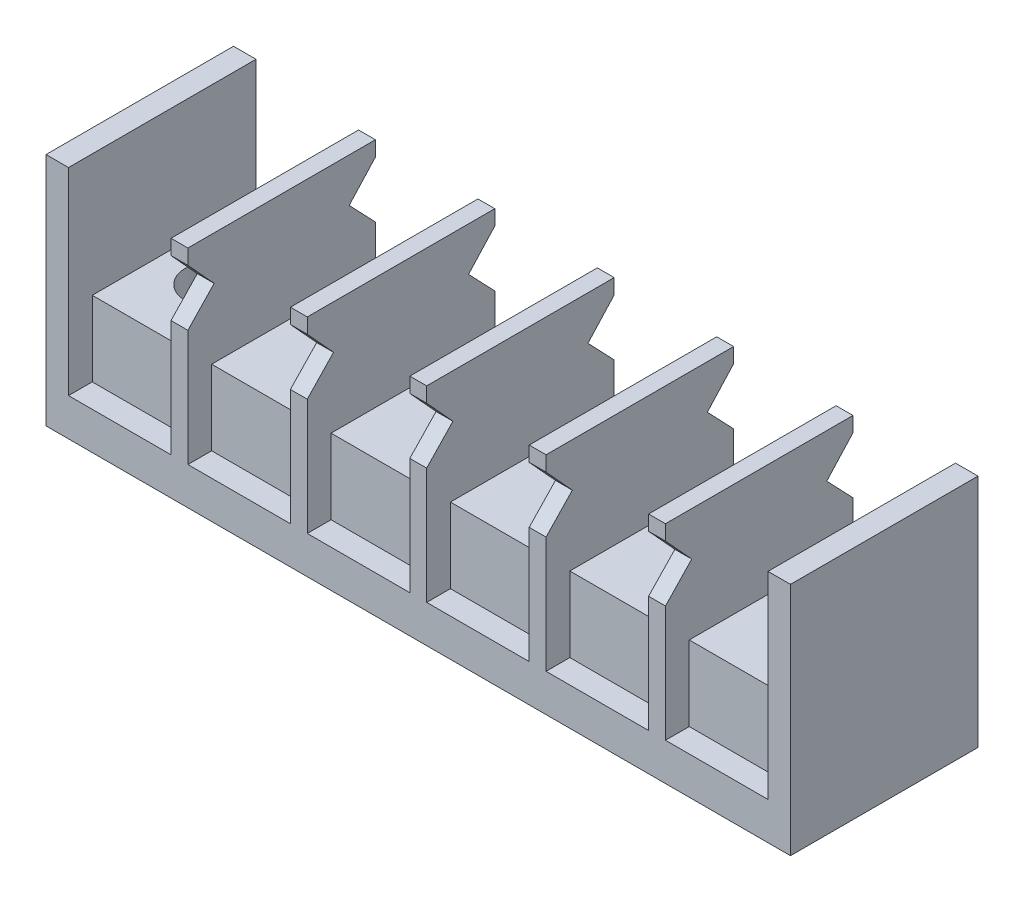
from build123d import *

# Parameters (mm, degrees)
SKETCH_1_W          = 59.55
SKETCH_1_H          = 15
EXTRUDE_1_DEPTH     = 18.8
SKETCH_2_W          = 55.95
SKETCH_2_H          = 15
CUT_EXTRUDE_1_DEPTH = 0.8
SKETCH_4_W          = 8.2
SKETCH_4_H          = 15
CUT_EXTRUDE_2_DEPTH = 9
SKETCH_5_W          = 8.2
SKETCH_5_H          = 1.9
CUT_EXTRUDE_3_DEPTH = 15
SKETCH_6_W          = 1.5
SKETCH_6_H          = 0.75
EXTRUDE_2_DEPTH     = 5.8
SKETCH_7_R          = 2.25
CUT_EXTRUDE_4_DEPTH = 35.085783327
CUT_EXTRUDE_START   = -39.55
CUT_EXTRUDE_5_DEPTH = 39.55


with BuildPart() as part:
    # 草图1 → 拉伸1 (new body)
    with BuildSketch(Plane(origin=(0, 0, 0), x_dir=(1, 0, 0), z_dir=(0, 1, 0))):
        Rectangle(SKETCH_1_W, SKETCH_1_H)
    extrude(amount=EXTRUDE_1_DEPTH)

    # 草图2 → 切除-拉伸1 (cut)
    with BuildSketch(Plane(origin=(0, 18.8, 0), x_dir=(-1, 0, 0), z_dir=(0, 1, 0))):
        Rectangle(SKETCH_2_W, SKETCH_2_H)
    extrude(amount=-CUT_EXTRUDE_1_DEPTH, mode=Mode.SUBTRACT)

    # 草图4 → 切除-拉伸2 (cut)
    with BuildSketch(Plane(origin=(0, 18, 0), x_dir=(-1, 0, 0), z_dir=(0, 1, 0))):
        with Locations((-23.875, 0)):
            Rectangle(SKETCH_4_W, SKETCH_4_H)
        with Locations((-14.325, 0)):
            Rectangle(SKETCH_4_W, SKETCH_4_H)
        with Locations((-4.775, 0)):
            Rectangle(SKETCH_4_W, SKETCH_4_H)
        with Locations((4.775, 0)):
            Rectangle(SKETCH_4_W, SKETCH_4_H)
        with Locations((14.325, 0)):
            Rectangle(SKETCH_4_W, SKETCH_4_H)
        with Locations((23.875, 0)):
            Rectangle(SKETCH_4_W, SKETCH_4_H)
    extrude(amount=-CUT_EXTRUDE_2_DEPTH, mode=Mode.SUBTRACT)

    # 草图5 → 切除-拉伸3 (cut)
    with BuildSketch(Plane(origin=(0, 18, 0), x_dir=(-1, 0, 0), z_dir=(0, 1, 0))):
        with Locations((23.875, -6.55)):
            Rectangle(SKETCH_5_W, SKETCH_5_H)
        with Locations((23.875, 6.55)):
            Rectangle(SKETCH_5_W, SKETCH_5_H)
        with Locations((14.325, -6.55)):
            Rectangle(SKETCH_5_W, SKETCH_5_H)
        with Locations((14.325, 6.55)):
            Rectangle(SKETCH_5_W, SKETCH_5_H)
        with Locations((4.775, -6.55)):
            Rectangle(SKETCH_5_W, SKETCH_5_H)
        with Locations((4.775, 6.55)):
            Rectangle(SKETCH_5_W, SKETCH_5_H)
        with Locations((-4.775, -6.55)):
            Rectangle(SKETCH_5_W, SKETCH_5_H)
        with Locations((-4.775, 6.55)):
            Rectangle(SKETCH_5_W, SKETCH_5_H)
        with Locations((-14.325, -6.55)):
            Rectangle(SKETCH_5_W, SKETCH_5_H)
        with Locations((-14.325, 6.55)):
            Rectangle(SKETCH_5_W, SKETCH_5_H)
        with Locations((-23.875, -6.55)):
            Rectangle(SKETCH_5_W, SKETCH_5_H)
        with Locations((-23.875, 6.55)):
            Rectangle(SKETCH_5_W, SKETCH_5_H)
    extrude(amount=-CUT_EXTRUDE_3_DEPTH, mode=Mode.SUBTRACT)

    # 草图6 → 拉伸2 (add)
    with BuildSketch(Plane.XZ):
        with Locations((-4.775, 0)):
            Rectangle(SKETCH_6_W, SKETCH_6_H)
        with Locations((4.775, 0)):
            Rectangle(SKETCH_6_W, SKETCH_6_H)
        with Locations((14.325, 0)):
            Rectangle(SKETCH_6_W, SKETCH_6_H)
        with Locations((-14.325, 0)):
            Rectangle(SKETCH_6_W, SKETCH_6_H)
    extrude(amount=EXTRUDE_2_DEPTH)

    # 草图7 → 切除-拉伸4 (cut, through all)
    with BuildSketch(Plane(origin=(0, 9, 0), x_dir=(-1, 0, 0), z_dir=(0, 1, 0))):
        with Locations(Location((-23.875, 0, 0), (0, 0, 90))):
            Circle(SKETCH_7_R)
        with Locations(Location((23.875, 0, 0), (0, 0, 270))):
            Circle(SKETCH_7_R)
    extrude(amount=-CUT_EXTRUDE_4_DEPTH, mode=Mode.SUBTRACT)

    # 草图8 → 切除-拉伸5 (cut)
    with BuildSketch(Plane(origin=(19.775, 0, 0), x_dir=(0, 0, -1), z_dir=(1, 0, 0)).offset(CUT_EXTRUDE_START)):
        Polygon((7.5, 16.8), (5.4, 14.5), (7.5, 12.3), align=None)
        Polygon((-7.5, 16.8), (-7.5, 12.3), (-5.4, 14.5), align=None)
    extrude(amount=CUT_EXTRUDE_5_DEPTH, mode=Mode.SUBTRACT)


solid = part.part
